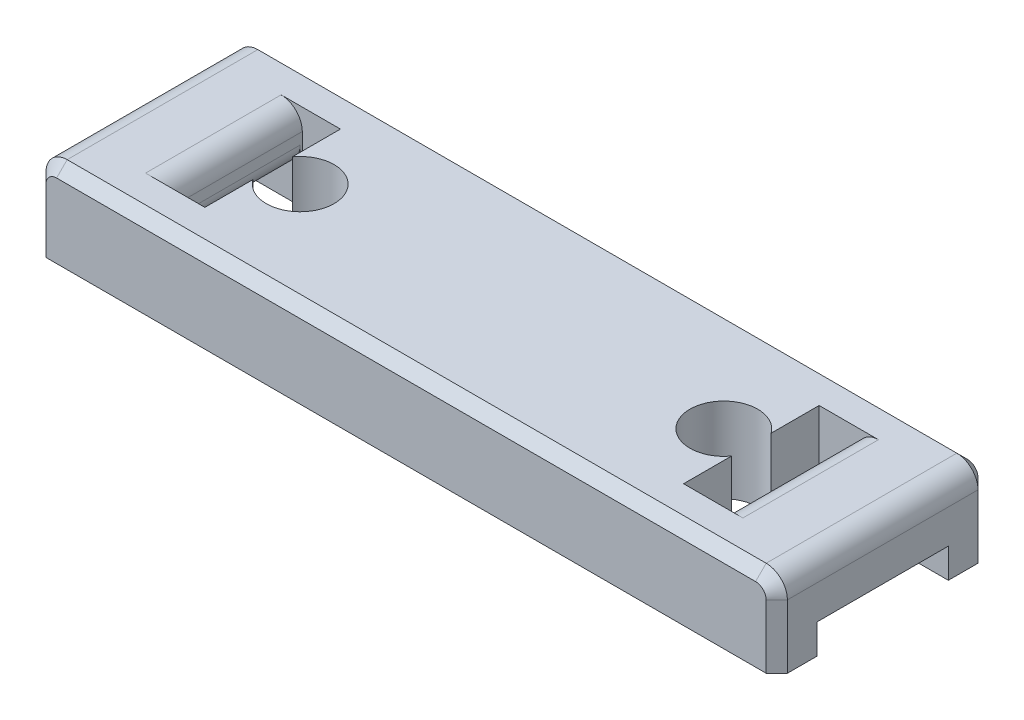
from build123d import *

# Parameters (mm, degrees)
SKETCH2_W           = 35
SKETCH2_H           = 10
BOSS_EXTRUDE1_DEPTH = 4
CUT_EXTRUDE1_DEPTH  = 4
SKETCH4_W           = 6.2
SKETCH4_H           = 1.5
CUT_EXTRUDE2_DEPTH  = 4.4
SKETCH5_W           = 6.2
SKETCH5_H           = 1.4
CUT_EXTRUDE3_DEPTH  = 4.4
FILLET1_R           = 1
FILLET2_R           = 1
CHAMFER1_SIZE       = 0.5


with BuildPart() as part:
    # Sketch2 → Boss-Extrude1 (new body)
    with BuildSketch(Plane(origin=(0, 0, 0), x_dir=(1, 0, 0), z_dir=(0, 1, 0))):
        Rectangle(SKETCH2_W, SKETCH2_H)
    extrude(amount=BOSS_EXTRUDE1_DEPTH)

    # Sketch3 → Cut-Extrude1 (cut)
    with BuildSketch(Plane(origin=(0, 4, 0), x_dir=(1, 0, 0), z_dir=(0, 1, 0))):
        with BuildLine():
            Line((-11.3, 0.932737905), (-11.3, 3.2))
            Line((-11.3, 3.2), (-13.1, 3.2))
            Line((-13.1, 3.2), (-13.1, -3.2))
            Line((-13.1, -3.2), (-11.3, -3.2))
            Line((-11.3, -3.2), (-11.3, -0.932737905))
            ThreePointArc((-11.3, -0.932737905), (-8.4, 0), (-11.3, 0.932737905))
        make_face()
        with BuildLine():
            Line((11.3, -3.2), (11.3, -0.932737905))
            ThreePointArc((11.3, -0.932737905), (8.4, 0), (11.3, 0.932737905))
            Line((11.3, 0.932737905), (11.3, 3.2))
            Line((11.3, 3.2), (13.1, 3.2))
            Line((13.1, 3.2), (13.1, -3.2))
            Line((13.1, -3.2), (11.3, -3.2))
        make_face()
    extrude(amount=-CUT_EXTRUDE1_DEPTH, mode=Mode.SUBTRACT)

    # Sketch4 → Cut-Extrude2 (cut)
    with BuildSketch(Plane.ZY.offset(17.5)):
        with Locations((0, 0.75)):
            Rectangle(SKETCH4_W, SKETCH4_H)
    extrude(amount=-CUT_EXTRUDE2_DEPTH, mode=Mode.SUBTRACT)

    # Sketch5 → Cut-Extrude3 (cut)
    with BuildSketch(Plane(origin=(17.5, 0, 0), x_dir=(0, 0, -1), z_dir=(1, 0, 0))):
        with Locations((0, 0.7)):
            Rectangle(SKETCH5_W, SKETCH5_H)
    extrude(amount=-CUT_EXTRUDE3_DEPTH, mode=Mode.SUBTRACT)

    # Fillet1
    fillet1_edges = [part.edges().sort_by_distance(p)[0] for p in [
        (-13.1, 4, 0),
        (13.1, 4, 0),
        (-13.1, 1.5, 0),
        (13.1, 1.4, 0),
    ]]
    fillet(fillet1_edges, radius=FILLET1_R)

    # Fillet2
    fillet2_edges = [part.edges().sort_by_distance(p)[0] for p in [
        (-17.5, 4, 0),
        (17.5, 4, 0),
    ]]
    fillet(fillet2_edges, radius=FILLET2_R)

    # Chamfer1
    chamfer1_edges = [part.edges().sort_by_distance(p)[0] for p in [
        (0, 4, -5),
        (0, 4, 5),
        (17.5, 1.5, 5),
        (-17.5, 1.5, 5),
        (17.207106781, 3.707106781, 5),
        (-17.207106781, 3.707106781, 5),
        (-17.5, 1.5, -5),
        (17.5, 1.5, -5),
        (17.207106781, 3.707106781, -5),
        (-17.207106781, 3.707106781, -5),
    ]]
    chamfer(chamfer1_edges, length=CHAMFER1_SIZE)


solid = part.part
